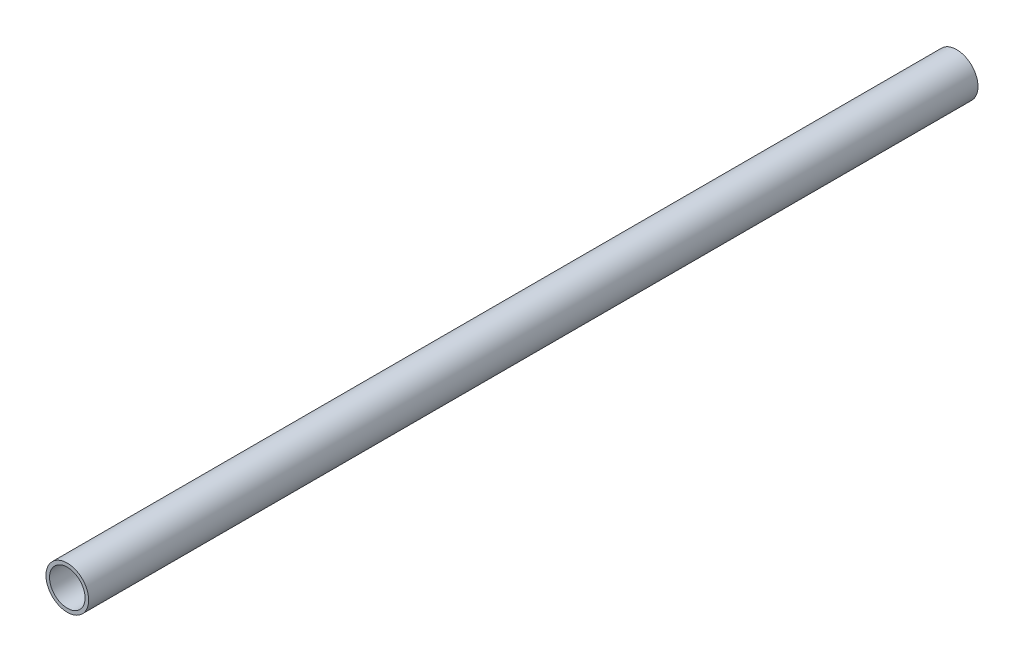
from build123d import *

# Parameters (mm, degrees)
SKETCH1_R           = 6
SKETCH1_R_2         = 5
BOSS_EXTRUDE1_DEPTH = 250


with BuildPart() as part:
    # Sketch1 → Boss-Extrude1 (new body)
    with BuildSketch(Plane.XY):
        Circle(SKETCH1_R)
        Circle(SKETCH1_R_2, mode=Mode.SUBTRACT)
    extrude(amount=BOSS_EXTRUDE1_DEPTH)


solid = part.part
